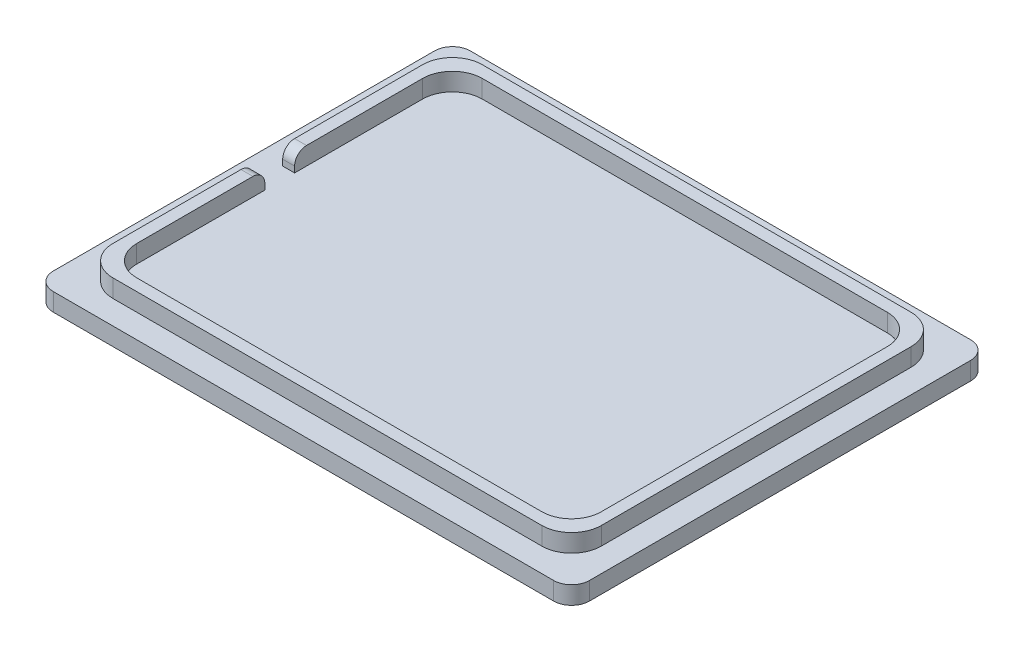
from build123d import *

# Parameters (mm, degrees)
ESBO_O1_W                = 90
ESBO_O1_H                = 70
RESSALTO_EXTRUS_O1_DEPTH = 3
ESBO_O1_3_W              = 82
ESBO_O1_3_H              = 62
ESBO_O1_3_W_2            = 78
ESBO_O1_3_H_2            = 58
RESSALTO_EXTRUS_O2_DEPTH = 6
FILETE1_R                = 3
FILETE2_R                = 5
CORTE_EXTRUS_O1_REACH    = 113.05
ESBO_O2_W                = 5
ESBO_O2_H                = 3
FILETE3_R                = 2


with BuildPart() as part:
    # Esboço1 → Ressalto-extrusão1 (new body)
    with BuildSketch(Plane(origin=(0, 0, 0), x_dir=(1, 0, 0), z_dir=(0, 1, 0))):
        with Locations((-45, 35)):
            Rectangle(ESBO_O1_W, ESBO_O1_H)
    extrude(amount=RESSALTO_EXTRUS_O1_DEPTH)

    # Esboço1<3> → Ressalto-extrusão2 (add)
    with BuildSketch(Plane(origin=(0, 0, 0), x_dir=(1, 0, 0), z_dir=(0, 1, 0))):
        with Locations((-45, 35)):
            Rectangle(ESBO_O1_3_W, ESBO_O1_3_H)
        with Locations((-45, 35)):
            Rectangle(ESBO_O1_3_W_2, ESBO_O1_3_H_2, mode=Mode.SUBTRACT)
    extrude(amount=RESSALTO_EXTRUS_O2_DEPTH)

    # Filete1
    filete1_edges = [part.edges().sort_by_distance(p)[0] for p in [
        (-90, 1.5, 0),
        (0, 1.5, 0),
        (0, 1.5, -70),
        (-90, 1.5, -70),
    ]]
    fillet(filete1_edges, radius=FILETE1_R)

    # Filete2
    filete2_edges = [part.edges().sort_by_distance(p)[0] for p in [
        (-84, 4.5, -6),
        (-86, 4.5, -4),
        (-4, 4.5, -4),
        (-6, 4.5, -6),
        (-6, 4.5, -64),
        (-4, 4.5, -66),
        (-84, 4.5, -64),
        (-86, 4.5, -66),
    ]]
    fillet(filete2_edges, radius=FILETE2_R)

    # Esboço2 → Corte-extrusão1 (cut, up to next)
    with BuildSketch(Plane.ZY.offset(86), mode=Mode.PRIVATE) as corte_extrus_o1_sk1:
        with Locations((-35, 4.5)):
            Rectangle(ESBO_O2_W, ESBO_O2_H)
    corte_extrus_o1_tool1 = extrude(corte_extrus_o1_sk1.sketch, amount=-CORTE_EXTRUS_O1_REACH, mode=Mode.PRIVATE) & part.part
    add(corte_extrus_o1_tool1.solids().sort_by_distance((-86, 4.5, -35))[0], mode=Mode.SUBTRACT)

    # Filete3
    filete3_edges = [part.edges().sort_by_distance(p)[0] for p in [
        (-85, 6, -32.5),
        (-85, 6, -37.5),
    ]]
    fillet(filete3_edges, radius=FILETE3_R)


solid = part.part
